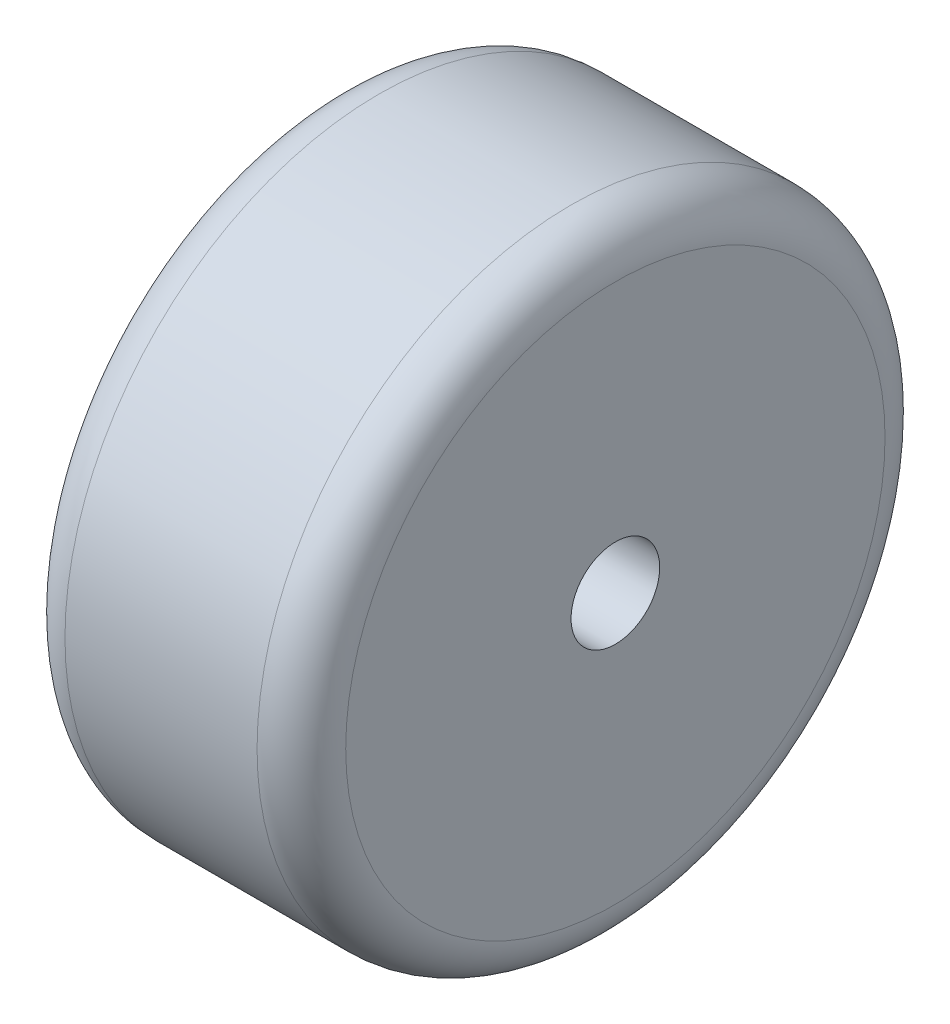
from build123d import *

# Parameters (mm, degrees)
SKETCH1_R           = 42.5
BOSS_EXTRUDE1_DEPTH = 38
FILLET2_R           = 6
SKETCH2_R           = 6
CUT_EXTRUDE2_DEPTH  = 38


with BuildPart() as part:
    # Sketch1 → Boss-Extrude1 (new body)
    with BuildSketch(Plane(origin=(0, 0, 0), x_dir=(0, 0, -1), z_dir=(1, 0, 0))):
        Circle(SKETCH1_R)
    extrude(amount=BOSS_EXTRUDE1_DEPTH)

    # Fillet2
    fillet2_edges = [part.edges().sort_by_distance(p)[0] for p in [
        (0, 0, 42.5),
        (38, 0, 42.5),
    ]]
    fillet(fillet2_edges, radius=FILLET2_R)

    # Sketch2 → Cut-Extrude2 (cut)
    with BuildSketch(Plane(origin=(38, 0, 0), x_dir=(0, 0, -1), z_dir=(1, 0, 0))):
        Circle(SKETCH2_R)
    extrude(amount=-CUT_EXTRUDE2_DEPTH, mode=Mode.SUBTRACT)


solid = part.part
